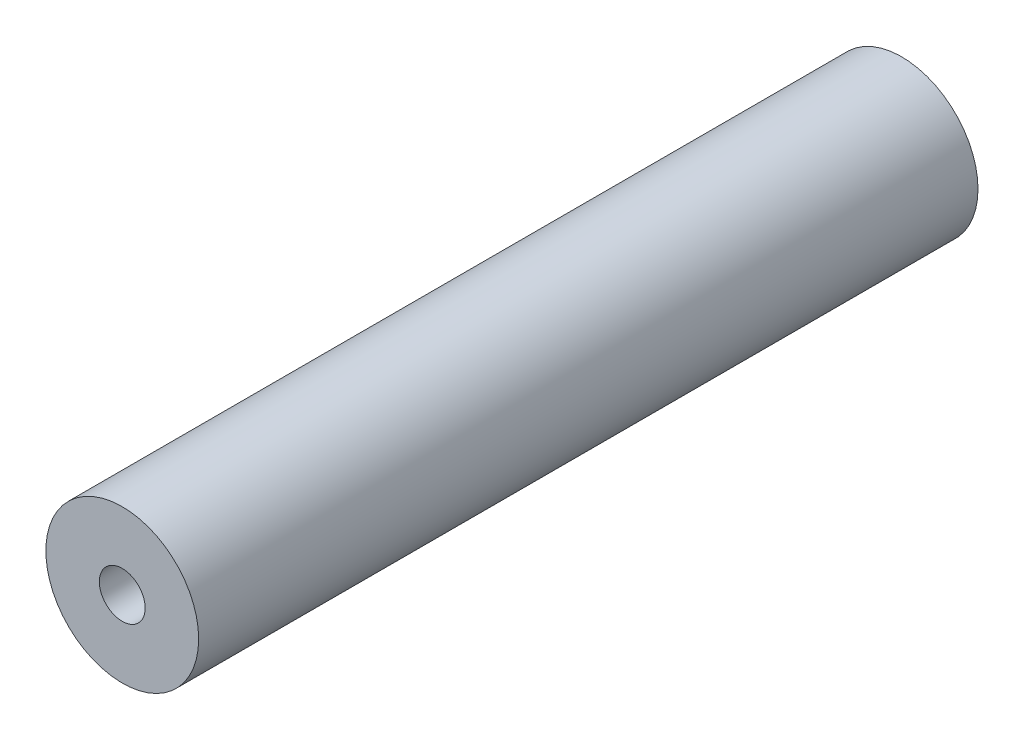
from build123d import *

# Parameters (mm, degrees)
SKETCH1_R           = 5
SKETCH1_R_2         = 1.5
BOSS_EXTRUDE1_DEPTH = 51


with BuildPart() as part:
    # Sketch1 → Boss-Extrude1 (new body)
    with BuildSketch(Plane.XY):
        Circle(SKETCH1_R)
        Circle(SKETCH1_R_2, mode=Mode.SUBTRACT)
    extrude(amount=BOSS_EXTRUDE1_DEPTH)


solid = part.part
